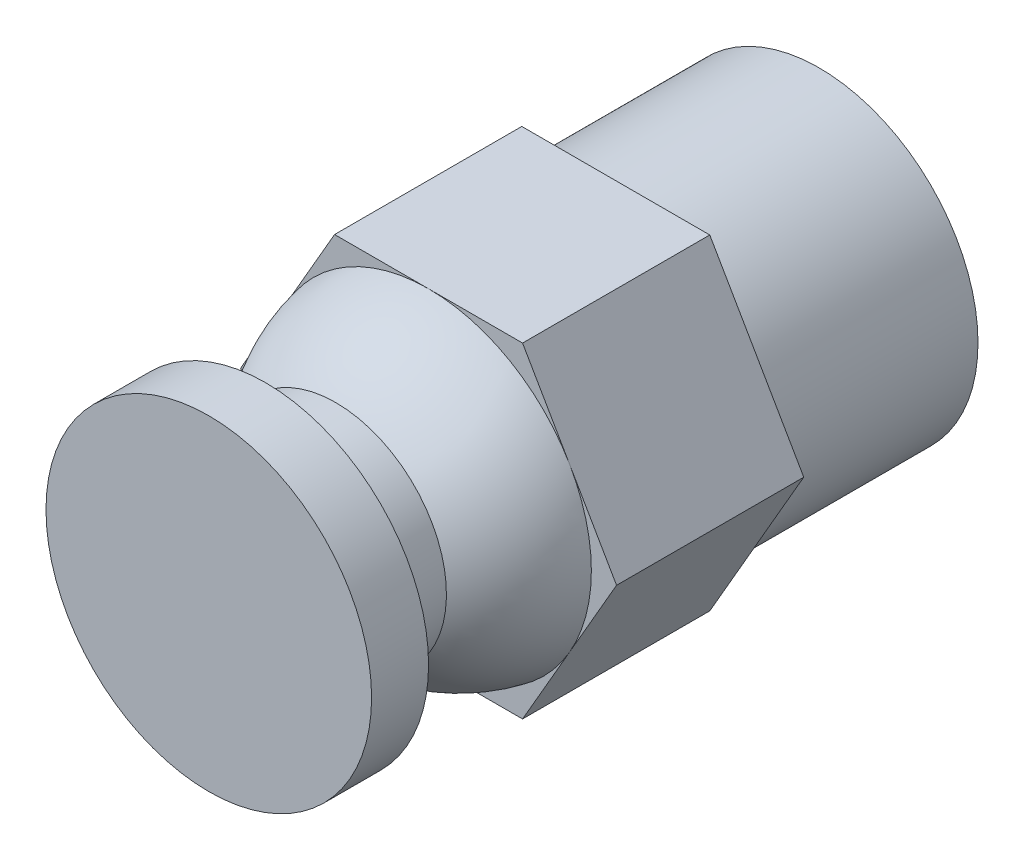
from build123d import *

# Parameters (mm, degrees)
SKETCH1_R           = 4.875
BOSS_EXTRUDE1_DEPTH = 6.25
BOSS_EXTRUDE2_DEPTH = 5.75
SKETCH3_R           = 5
BOSS_EXTRUDE3_DEPTH = 6.75


with BuildPart() as part:
    # Sketch1 → Boss-Extrude1 (new body)
    with BuildSketch(Plane.XY):
        Circle(SKETCH1_R)
    extrude(amount=BOSS_EXTRUDE1_DEPTH)

    # Sketch2 → Boss-Extrude2 (add)
    with BuildSketch(Plane.XY.offset(6.25)):
        Polygon((5.773502692, 0), (2.886751346, 5), (-2.886751346, 5), (-5.773502692, 0), (-2.886751346, -5), (2.886751346, -5), align=None)
    extrude(amount=BOSS_EXTRUDE2_DEPTH)

    # Sketch3 → Boss-Extrude3 (add)
    with BuildSketch(Plane.XY.offset(12)):
        with Locations(Location((0, 0, 0), (0, 0, 150))):
            Circle(SKETCH3_R)
    extrude(amount=BOSS_EXTRUDE3_DEPTH)

    # Sketch4 → Cut-Revolve1 (revolve, cut)
    with BuildSketch(Plane(origin=(0, 0, 0), x_dir=(0, 0, -1), z_dir=(1, 0, 0))):
        with BuildLine():
            Line((-17, 5), (-17, 3.4))
            Line((-17, 3.4), (-14.850952939, 3.4))
            ThreePointArc((-14.850952939, 3.4), (-13.557536702, 4.435310943), (-12, 5))
            Line((-12, 5), (-17, 5))
        make_face()
    revolve(axis=Axis((0, 0, 12), (0, 0, 1)), mode=Mode.SUBTRACT)


solid = part.part
